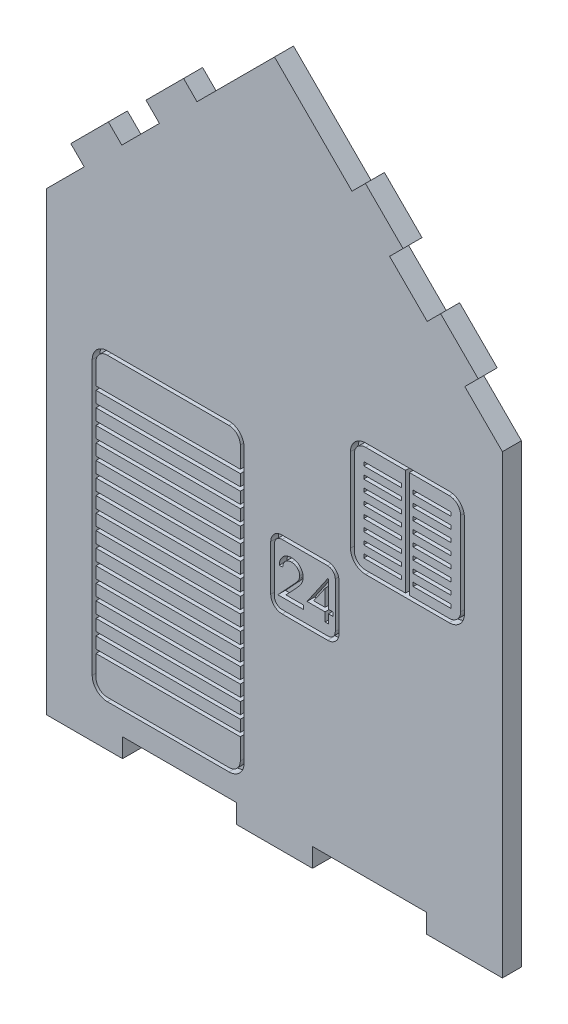
from build123d import *

# Parameters (mm, degrees)
BOSS_EXTRUDE1_DEPTH = 2.5
SKETCH2_W           = 5
SKETCH2_H           = 0.5
SKETCH2_W_2         = 0.5
SKETCH2_H_2         = 14
SKETCH2_W_3         = 19
CUT_EXTRUDE1_DEPTH  = 1
CUT_EXTRUDE2_DEPTH  = 1


with BuildPart() as part:
    # Sketch1 → Boss-Extrude1 (new body)
    with BuildSketch(Plane.XY):
        Polygon((-30, 30), (-30, -30), (-20, -30), (-20, -27.5), (-5, -27.5), (-5, -30), (5, -30), (5, -27.5), (20, -27.5), (20, -30), (30, -30), (30, 30), (25.050252532, 34.949747468), (26.818019485, 36.717514421), (21.868272016, 41.66726189), (20.100505063, 39.899494937), (15.150757595, 44.849242405), (16.918524548, 46.617009358), (11.96877708, 51.566756826), (10.201010127, 49.798989873), (0, 60), (-10.201010127, 49.798989873), (-11.96877708, 51.566756826), (-16.918524548, 46.617009358), (-15.150757595, 44.849242405), (-20.100505063, 39.899494937), (-21.868272016, 41.66726189), (-26.818019485, 36.717514421), (-25.050252532, 34.949747468), align=None)
    extrude(amount=BOSS_EXTRUDE1_DEPTH)

    # Sketch2 → Cut-Extrude1 (cut)
    # profile 1 of 36: a face of its own
    with BuildSketch(Plane.XY.offset(2.5)):
        with BuildLine():
            ThreePointArc((23, 22), (24.414213562, 21.414213562), (25, 20))
            Line((25, 20), (25, 9))
            ThreePointArc((25, 9), (24.414213562, 7.585786438), (23, 7))
            Line((23, 7), (12, 7))
            ThreePointArc((12, 7), (10.585786438, 7.585786438), (10, 9))
            Line((10, 9), (10, 20))
            ThreePointArc((10, 20), (10.585786438, 21.414213562), (12, 22))
            Line((12, 22), (23, 22))
        make_face()
        with BuildLine():
            Line((12, 7.5), (23, 7.5))
            ThreePointArc((23, 7.5), (24.060660172, 7.939339828), (24.5, 9))
            Line((24.5, 9), (24.5, 20))
            ThreePointArc((24.5, 20), (24.060660172, 21.060660172), (23, 21.5))
            Line((23, 21.5), (12, 21.5))
            ThreePointArc((12, 21.5), (10.939339828, 21.060660172), (10.5, 20))
            Line((10.5, 20), (10.5, 9))
            ThreePointArc((10.5, 9), (10.939339828, 7.939339828), (12, 7.5))
        make_face(mode=Mode.SUBTRACT)
    # profile 2 of 36: a face of its own
    with BuildSketch(Plane.XY.offset(2.5)):
        with Locations((14.25, 15)):
            Rectangle(SKETCH2_W, SKETCH2_H)
    # profile 3 of 36: a face of its own
    with BuildSketch(Plane.XY.offset(2.5)):
        with Locations((14.25, 13.5)):
            Rectangle(SKETCH2_W, SKETCH2_H)
    # profile 4 of 36: a face of its own
    with BuildSketch(Plane.XY.offset(2.5)):
        with Locations((14.25, 12)):
            Rectangle(SKETCH2_W, SKETCH2_H)
    # profile 5 of 36: a face of its own
    with BuildSketch(Plane.XY.offset(2.5)):
        with Locations((14.25, 10.5)):
            Rectangle(SKETCH2_W, SKETCH2_H)
    # profile 6 of 36: a face of its own
    with BuildSketch(Plane.XY.offset(2.5)):
        with Locations((14.25, 9)):
            Rectangle(SKETCH2_W, SKETCH2_H)
    # profile 7 of 36: a face of its own
    with BuildSketch(Plane.XY.offset(2.5)):
        with Locations((20.75, 9)):
            Rectangle(SKETCH2_W, SKETCH2_H)
    # profile 8 of 36: a face of its own
    with BuildSketch(Plane.XY.offset(2.5)):
        with Locations((20.75, 10.5)):
            Rectangle(SKETCH2_W, SKETCH2_H)
    # profile 9 of 36: a face of its own
    with BuildSketch(Plane.XY.offset(2.5)):
        with Locations((20.75, 12)):
            Rectangle(SKETCH2_W, SKETCH2_H)
    # profile 10 of 36: a face of its own
    with BuildSketch(Plane.XY.offset(2.5)):
        with Locations((20.75, 13.5)):
            Rectangle(SKETCH2_W, SKETCH2_H)
    # profile 11 of 36: a face of its own
    with BuildSketch(Plane.XY.offset(2.5)):
        with Locations((20.75, 15)):
            Rectangle(SKETCH2_W, SKETCH2_H)
    # profile 12 of 36: a face of its own
    with BuildSketch(Plane.XY.offset(2.5)):
        with Locations((17.5, 14.5)):
            Rectangle(SKETCH2_W_2, SKETCH2_H_2)
    # profile 13 of 36: a face of its own
    with BuildSketch(Plane.XY.offset(2.5)):
        with BuildLine():
            ThreePointArc((-6, 15.5), (-4.585786438, 14.914213562), (-4, 13.5))
            Line((-4, 13.5), (-4, -22.5))
            ThreePointArc((-4, -22.5), (-4.585786438, -23.914213562), (-6, -24.5))
            Line((-6, -24.5), (-22, -24.5))
            ThreePointArc((-22, -24.5), (-23.414213562, -23.914213562), (-24, -22.5))
            Line((-24, -22.5), (-24, 13.5))
            ThreePointArc((-24, 13.5), (-23.414213562, 14.914213562), (-22, 15.5))
            Line((-22, 15.5), (-6, 15.5))
        make_face()
        with BuildLine():
            Line((-22, -24), (-6, -24))
            ThreePointArc((-6, -24), (-4.939339828, -23.560660172), (-4.5, -22.5))
            Line((-4.5, -22.5), (-4.5, 13.5))
            ThreePointArc((-4.5, 13.5), (-4.939339828, 14.560660172), (-6, 15))
            Line((-6, 15), (-22, 15))
            ThreePointArc((-22, 15), (-23.060660172, 14.560660172), (-23.5, 13.5))
            Line((-23.5, 13.5), (-23.5, -22.5))
            ThreePointArc((-23.5, -22.5), (-23.060660172, -23.560660172), (-22, -24))
        make_face(mode=Mode.SUBTRACT)
    # profile 14 of 36: a face of its own
    with BuildSketch(Plane.XY.offset(2.5)):
        with Locations((-14, 10.5)):
            Rectangle(SKETCH2_W_3, SKETCH2_H)
    # profile 15 of 36: a face of its own
    with BuildSketch(Plane.XY.offset(2.5)):
        with Locations((-14, 8.5)):
            Rectangle(SKETCH2_W_3, SKETCH2_H)
    # profile 16 of 36: a face of its own
    with BuildSketch(Plane.XY.offset(2.5)):
        with Locations((-14, 6.5)):
            Rectangle(SKETCH2_W_3, SKETCH2_H)
    # profile 17 of 36: a face of its own
    with BuildSketch(Plane.XY.offset(2.5)):
        with Locations((-14, 4.5)):
            Rectangle(SKETCH2_W_3, SKETCH2_H)
    # profile 18 of 36: a face of its own
    with BuildSketch(Plane.XY.offset(2.5)):
        with Locations((-14, 2.5)):
            Rectangle(SKETCH2_W_3, SKETCH2_H)
    # profile 19 of 36: a face of its own
    with BuildSketch(Plane.XY.offset(2.5)):
        with Locations((-14, 0.5)):
            Rectangle(SKETCH2_W_3, SKETCH2_H)
    # profile 20 of 36: a face of its own
    with BuildSketch(Plane.XY.offset(2.5)):
        with Locations((-14, -1.5)):
            Rectangle(SKETCH2_W_3, SKETCH2_H)
    # profile 21 of 36: a face of its own
    with BuildSketch(Plane.XY.offset(2.5)):
        with Locations((-14, -5.5)):
            Rectangle(SKETCH2_W_3, SKETCH2_H)
    # profile 22 of 36: a face of its own
    with BuildSketch(Plane.XY.offset(2.5)):
        with Locations((-14, -7.5)):
            Rectangle(SKETCH2_W_3, SKETCH2_H)
    # profile 23 of 36: a face of its own
    with BuildSketch(Plane.XY.offset(2.5)):
        with Locations((-14, -9.5)):
            Rectangle(SKETCH2_W_3, SKETCH2_H)
    # profile 24 of 36: a face of its own
    with BuildSketch(Plane.XY.offset(2.5)):
        with Locations((-14, -3.5)):
            Rectangle(SKETCH2_W_3, SKETCH2_H)
    # profile 25 of 36: a face of its own
    with BuildSketch(Plane.XY.offset(2.5)):
        with Locations((-14, -11.5)):
            Rectangle(SKETCH2_W_3, SKETCH2_H)
    # profile 26 of 36: a face of its own
    with BuildSketch(Plane.XY.offset(2.5)):
        with Locations((-14, -13.5)):
            Rectangle(SKETCH2_W_3, SKETCH2_H)
    # profile 27 of 36: a face of its own
    with BuildSketch(Plane.XY.offset(2.5)):
        with Locations((-14, -15.5)):
            Rectangle(SKETCH2_W_3, SKETCH2_H)
    # profile 28 of 36: a face of its own
    with BuildSketch(Plane.XY.offset(2.5)):
        with Locations((-14, -17.5)):
            Rectangle(SKETCH2_W_3, SKETCH2_H)
    # profile 29 of 36: a face of its own
    with BuildSketch(Plane.XY.offset(2.5)):
        with Locations((-14, -19.5)):
            Rectangle(SKETCH2_W_3, SKETCH2_H)
    # profile 30 of 36: a face of its own
    with BuildSketch(Plane.XY.offset(2.5)):
        with Locations((14.25, 16.5)):
            Rectangle(SKETCH2_W, SKETCH2_H)
    # profile 31 of 36: a face of its own
    with BuildSketch(Plane.XY.offset(2.5)):
        with Locations((14.25, 18)):
            Rectangle(SKETCH2_W, SKETCH2_H)
    # profile 32 of 36: a face of its own
    with BuildSketch(Plane.XY.offset(2.5)):
        with Locations((14.25, 19.5)):
            Rectangle(SKETCH2_W, SKETCH2_H)
    # profile 33 of 36: a face of its own
    with BuildSketch(Plane.XY.offset(2.5)):
        with Locations((20.75, 18)):
            Rectangle(SKETCH2_W, SKETCH2_H)
    # profile 34 of 36: a face of its own
    with BuildSketch(Plane.XY.offset(2.5)):
        with BuildLine():
            ThreePointArc((1, -3), (-0.060660172, -2.560660172), (-0.5, -1.5))
            Line((-0.5, -1.5), (-0.5, 4.5))
            ThreePointArc((-0.5, 4.5), (-0.060660172, 5.560660172), (1, 6))
            Line((1, 6), (7, 6))
            ThreePointArc((7, 6), (8.060660172, 5.560660172), (8.5, 4.5))
            Line((8.5, 4.5), (8.5, -1.5))
            ThreePointArc((8.5, -1.5), (8.060660172, -2.560660172), (7, -3))
            Line((7, -3), (1, -3))
        make_face()
        with BuildLine():
            Line((1, 5.5), (7, 5.5))
            ThreePointArc((7, 5.5), (7.707106781, 5.207106781), (8, 4.5))
            Line((8, 4.5), (8, -1.5))
            ThreePointArc((8, -1.5), (7.707106781, -2.207106781), (7, -2.5))
            Line((7, -2.5), (1, -2.5))
            ThreePointArc((1, -2.5), (0.292893219, -2.207106781), (0, -1.5))
            Line((0, -1.5), (0, 4.5))
            ThreePointArc((0, 4.5), (0.292893219, 5.207106781), (1, 5.5))
        make_face(mode=Mode.SUBTRACT)
    # profile 35 of 36: a face of its own
    with BuildSketch(Plane.XY.offset(2.5)):
        with Locations((20.75, 19.5)):
            Rectangle(SKETCH2_W, SKETCH2_H)
    # profile 36 of 36: a face of its own
    with BuildSketch(Plane.XY.offset(2.5)):
        with Locations((20.75, 16.5)):
            Rectangle(SKETCH2_W, SKETCH2_H)
    extrude(amount=-CUT_EXTRUDE1_DEPTH, mode=Mode.SUBTRACT)

    # Sketch4 → Cut-Extrude2 (cut)
    # profile 1 of 2: a face of its own
    with BuildSketch(Plane.XY.offset(2.5)):
        with BuildLine():
            Line((1.075574345, 2.374793773), (0.626856396, 2.374793773))
            add(Edge.make_bspline(
                [(0.626856396, 2.374793773), (0.6297809, 2.434323613), (0.635524549, 2.551238634), (0.662422105, 2.721701357), (0.700909073, 2.884636784), (0.755325435, 3.038736661), (0.822905832, 3.185363528), (0.903948728, 3.323934979), (0.999939944, 3.453922392), (1.108806706, 3.574120739), (1.227047619, 3.684388698), (1.354627533, 3.779610473), (1.488691858, 3.860064289), (1.628833856, 3.927323206), (1.776634661, 3.9778087), (1.93075303, 4.015268186), (2.091866082, 4.037805822), (2.201637542, 4.040228373), (2.25746537, 4.04146044)],
                knots=[0, 0, 0, 0, 1.10065271, 2.161652631, 3.183658789, 4.190468796, 5.17591951, 6.163126047, 7.15150782, 8.156236427, 9.156009102, 10.134482811, 11.092018607, 12.041330605, 13.001268258, 13.972401359, 14.968799086, 16, 16, 16, 16], degree=3))
            add(Edge.make_bspline(
                [(2.25746537, 4.04146044), (2.312291191, 4.040176931), (2.420021969, 4.037654881), (2.577253418, 4.015996268), (2.726935267, 3.982073994), (2.868774934, 3.934480542), (3.00164074, 3.870502789), (3.126530804, 3.793649162), (3.244931962, 3.704763688), (3.351513081, 3.600115384), (3.449381766, 3.488397691), (3.533813559, 3.369129258), (3.606118078, 3.245944564), (3.666386193, 3.117904276), (3.710752105, 2.983802807), (3.74443526, 2.845592517), (3.763474422, 2.701842787), (3.766396456, 2.604547708), (3.767882037, 2.555082235)],
                knots=[0, 0, 0, 0, 1.111607364, 2.184268762, 3.212621178, 4.221274766, 5.211760367, 6.196651075, 7.1921475, 8.207485113, 9.220403448, 10.201281604, 11.166441695, 12.114753415, 13.065576456, 14.026450734, 14.996634279, 16, 16, 16, 16], degree=3))
            add(Edge.make_bspline(
                [(3.767882037, 2.555082235), (3.76546309, 2.485442471), (3.760667645, 2.347385023), (3.719647107, 2.144506648), (3.655580663, 1.94794462), (3.578441582, 1.789748474), (3.500623805, 1.662272055), (3.430498794, 1.557316762), (3.348406207, 1.44430895), (3.253151209, 1.32362704), (3.146704249, 1.194325747), (3.028101159, 1.056483182), (2.896496184, 0.91152351), (2.804126898, 0.812515509), (2.756263447, 0.761212042)],
                knots=[0, 0, 0, 0, 1.184426356, 2.348067706, 3.509069118, 4.696110526, 5.333549288, 6.050745305, 6.844228056, 7.710549037, 8.667450064, 9.695053472, 10.805634456, 12, 12, 12, 12], degree=3))
            Line((2.756263447, 0.761212042), (1.505261845, -0.573924176))
            Line((1.505261845, -0.573924176), (3.831984601, -0.573924176))
            Line((3.831984601, -0.573924176), (3.831984601, -1.086744688))
            Line((3.831984601, -1.086744688), (0.434548704, -1.086744688))
            Line((0.434548704, -1.086744688), (2.373651268, 0.982566209))
            add(Edge.make_bspline(
                [(2.373651268, 0.982566209), (2.420862535, 1.031849504), (2.511545716, 1.126512628), (2.63980654, 1.264716857), (2.755005095, 1.392930486), (2.857887085, 1.51091127), (2.946220664, 1.620384938), (3.024609567, 1.717805943), (3.087417554, 1.807455158), (3.155582405, 1.911370321), (3.221602378, 2.038245059), (3.278334315, 2.193293187), (3.312926956, 2.352903548), (3.317076721, 2.460763601), (3.319164088, 2.515018132)],
                knots=[0, 0, 0, 0, 1.329631726, 2.553950428, 3.673215718, 4.687767853, 5.603093632, 6.413772471, 7.123043292, 7.734684054, 8.834405432, 9.900288307, 10.943827018, 12, 12, 12, 12], degree=3))
            add(Edge.make_bspline(
                [(3.319164088, 2.515018132), (3.318255885, 2.549134416), (3.316465991, 2.616371059), (3.30066928, 2.714950715), (3.276797129, 2.810043306), (3.242589617, 2.901941333), (3.197437131, 2.989720836), (3.14247516, 3.073488665), (3.079060784, 3.154472901), (3.005701827, 3.230406184), (2.925113942, 3.299950763), (2.8399793, 3.361556599), (2.749907722, 3.413041043), (2.655278976, 3.455246039), (2.556356877, 3.488353727), (2.452950098, 3.511294555), (2.345344361, 3.525698103), (2.271867938, 3.52764692), (2.234428512, 3.528639927)],
                knots=[0, 0, 0, 0, 0.991446411, 1.95395049, 2.89581595, 3.838931463, 4.798493298, 5.75982156, 6.748411868, 7.785213223, 8.824556874, 9.840280684, 10.836137867, 11.835679398, 12.848801643, 13.863922112, 14.911575587, 16, 16, 16, 16], degree=3))
            add(Edge.make_bspline(
                [(2.234428512, 3.528639927), (2.195327322, 3.527618452), (2.118539042, 3.525612445), (2.005797566, 3.511580068), (1.898246455, 3.487371724), (1.795615165, 3.454262189), (1.697730043, 3.412178548), (1.605067123, 3.35976177), (1.517834424, 3.297213923), (1.435867962, 3.226298842), (1.360347992, 3.147345126), (1.293995312, 3.059330893), (1.236018149, 2.963863157), (1.18543353, 2.861199513), (1.144353972, 2.750408399), (1.112963757, 2.631883106), (1.088125405, 2.506138276), (1.079827518, 2.41930244), (1.075574345, 2.374793773)],
                knots=[0, 0, 0, 0, 1.031018746, 2.02475058, 2.990194455, 3.934040569, 4.864654155, 5.795059489, 6.735614925, 7.690564532, 8.649604399, 9.611025574, 10.590972636, 11.591080095, 12.624614302, 13.701020113, 14.821632451, 16, 16, 16, 16], degree=3))
        make_face()
    # profile 2 of 2: a face of its own
    with BuildSketch(Plane.XY.offset(2.5)):
        Polygon((7.010069537, 4.04146044), (7.10121537, 4.04146044), (7.10121537, 0.579921978), (7.678138447, 0.579921978), (7.678138447, 0.067101465), (7.10121537, 0.067101465), (7.10121537, -1.086744688), (6.652497422, -1.086744688), (6.652497422, 0.067101465), (4.28070255, 0.067101465), align=None)
        Polygon((6.652497422, 0.579921978), (6.652497422, 2.751396337), (5.162112806, 0.579921978), align=None, mode=Mode.SUBTRACT)
    extrude(amount=-CUT_EXTRUDE2_DEPTH, mode=Mode.SUBTRACT)


solid = part.part
